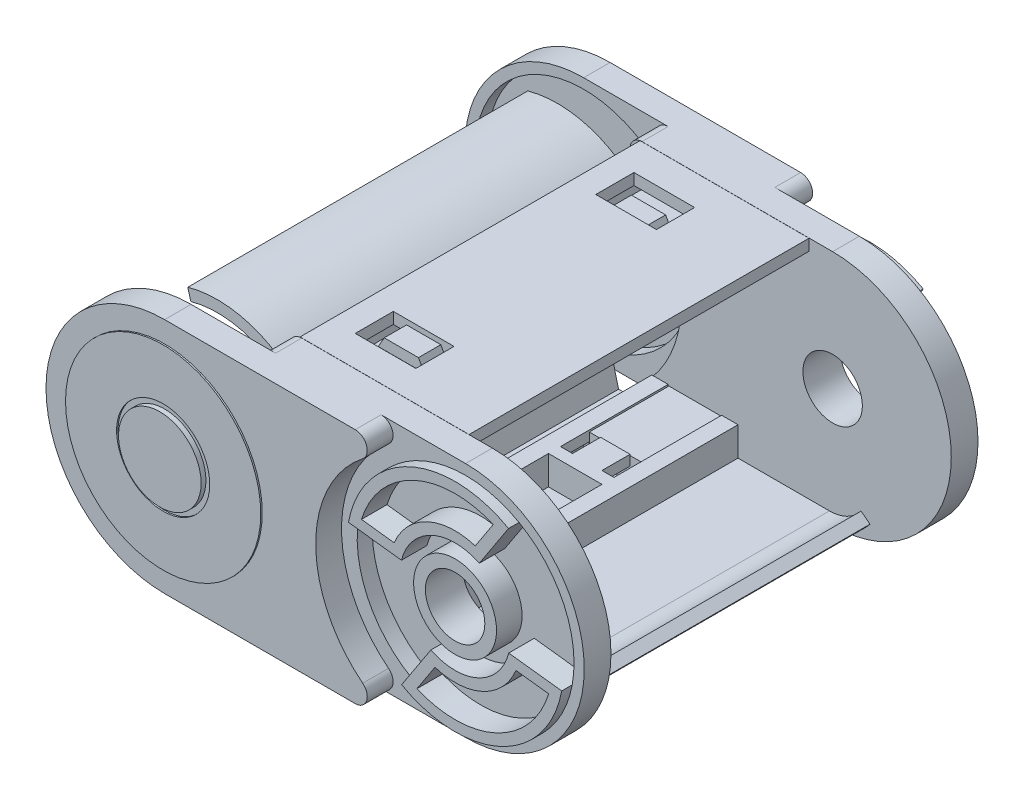
from build123d import *

# Parameters (mm, degrees)
BOSS_EXTRUDE1_START      = 37.075
BOSS_EXTRUDE1_DEPTH      = 8.75
SKETCH3_R                = 20.65
CUT_EXTRUDE2_DEPTH       = 4.3
SKETCH3_3_R              = 5.15
CUT_EXTRUDE10_DEPTH      = 70.017588338
SKETCH3_4_R              = 16.25
SKETCH3_4_R_2            = 7.75
BOSS_EXTRUDE11_DEPTH     = 0.25
SKETCH8_R                = 20.65
CUT_EXTRUDE6_DEPTH       = 4.35
CUT_EXTRUDE7_START       = 4.35
SKETCH9_R                = 18.1
CUT_EXTRUDE7_DEPTH       = 6.5
SKETCH10_R               = 7
BOSS_EXTRUDE3_DEPTH      = 3.9
FILLET1_R                = 0.5
CUT_EXTRUDE8_START       = -4.6
SKETCH11_R               = 7
CUT_EXTRUDE8_DEPTH       = 4.6
FILLET2_R                = 2
SKETCH20_R               = 4.95
CUT_EXTRUDE11_DEPTH      = 69.611715472
SKETCH20_3_R             = 18.05
CUT_EXTRUDE12_DEPTH      = 2.5
BOSS_EXTRUDE12_START     = 4.25
SKETCH21_R               = 6.9
SKETCH21_R_2             = 4.95
BOSS_EXTRUDE12_DEPTH     = 4.25
BOSS_EXTRUDE4_DEPTH      = 13.25
BOSS_EXTRUDE5_START      = -1.1
BOSS_EXTRUDE5_DEPTH      = 4.4
BOSS_EXTRUDE6_DEPTH      = 28.3
SKETCH15_W               = 10.1
SKETCH15_H               = 6.35
CUT_EXTRUDE9_DEPTH       = 5
BOSS_EXTRUDE7_REACH      = 84.254
SKETCH16_W               = 14.35
SKETCH16_H               = 20.75
SKETCH16_W_2             = 8.9
SKETCH16_H_2             = 16.75
SKETCH17_W               = 4.9
SKETCH17_H               = 4.675
BOSS_EXTRUDE8_DEPTH      = 1.7
SKETCH18_R               = 6.875
BOSS_EXTRUDE9_DEPTH      = 0.8
SKETCH19_R               = 5.1
BOSS_EXTRUDE10_DEPTH     = 8
SKETCH22_W               = 12.15
SKETCH22_H               = 56.65
CUT_EXTRUDE13_DEPTH      = 86.39067938
CUT_EXTRUDE14_DEPTH      = 79.239252457
CUT_EXTRUDE14_DEPTH_BACK = 79.239252457
SKETCH24_W               = 38.20570809
SKETCH24_H               = 12.218638483
BOSS_EXTRUDE13_START     = -28.3
BOSS_EXTRUDE13_DEPTH     = 56.6


with BuildPart() as part:
    # Sketch1 → Boss-Extrude1 (new body)
    with BuildSketch(Plane.XY.offset(BOSS_EXTRUDE1_START)):
        with BuildLine():
            Line((0, 19.75), (45.8, 19.75))
            ThreePointArc((45.8, 19.75), (65.55, 0), (45.8, -19.75))
            Line((45.8, -19.75), (0, -19.75))
            ThreePointArc((0, -19.75), (-19.75, 0), (0, 19.75))
        make_face()
    extrude(amount=-BOSS_EXTRUDE1_DEPTH)

    # Sketch3 → Cut-Extrude2 (cut)
    with BuildSketch(Plane.XY.offset(37.075)):
        with Locations((45.8, 0)):
            Circle(SKETCH3_R)
    extrude(amount=-CUT_EXTRUDE2_DEPTH, mode=Mode.SUBTRACT)

    # Sketch3<3> → Cut-Extrude10 (cut, through all)
    with BuildSketch(Plane.XY.offset(37.075)):
        Circle(SKETCH3_3_R)
    extrude(amount=-CUT_EXTRUDE10_DEPTH, mode=Mode.SUBTRACT)

    # Sketch3<4> → Boss-Extrude11 (add)
    with BuildSketch(Plane.XY.offset(37.075)):
        Circle(SKETCH3_4_R)
        Circle(SKETCH3_4_R_2, mode=Mode.SUBTRACT)
    extrude(amount=BOSS_EXTRUDE11_DEPTH)

    # Sketch8 → Cut-Extrude6 (cut)
    with BuildSketch(Plane(origin=(0, 0, 28.325), x_dir=(-1, 0, 0), z_dir=(0, 0, -1))):
        Circle(SKETCH8_R)
    extrude(amount=-CUT_EXTRUDE6_DEPTH, mode=Mode.SUBTRACT)

    # Sketch9 → Cut-Extrude7 (cut)
    with BuildSketch(Plane(origin=(0, 0, 32.675), x_dir=(-1, 0, 0), z_dir=(0, 0, -1)).offset(CUT_EXTRUDE7_START)):
        Circle(SKETCH9_R)
    extrude(amount=-CUT_EXTRUDE7_DEPTH, mode=Mode.SUBTRACT)

    # Sketch10 → Boss-Extrude3 (add)
    with BuildSketch(Plane(origin=(0, 0, 34.825), x_dir=(-1, 0, 0), z_dir=(0, 0, -1))):
        with BuildLine():
            Line((8.562499635, 2.5), (16.75, 3.2))
            Line((16.75, 3.2), (16.75, -3.2))
            Line((16.75, -3.2), (8.562499635, -2.5))
            ThreePointArc((8.562499635, -2.5), (0, -8.92), (-8.562499635, -2.5))
            Line((-8.562499635, -2.5), (-16.75, -3.2))
            Line((-16.75, -3.2), (-16.75, 3.2))
            Line((-16.75, 3.2), (-8.562499635, 2.5))
            ThreePointArc((-8.562499635, 2.5), (0, 8.92), (8.562499635, 2.5))
        make_face()
        Circle(SKETCH10_R, mode=Mode.SUBTRACT)
        with BuildLine():
            Line((8.872361267, 0.920654955), (15.15, 1.457369083))
            Line((15.15, 1.457369083), (15.15, -1.457369083))
            Line((15.15, -1.457369083), (8.872361267, -0.920654955))
            ThreePointArc((8.872361267, -0.920654955), (8.92, 0), (8.872361267, 0.920654955))
        make_face(mode=Mode.SUBTRACT)
        with BuildLine():
            Line((-8.872361267, 0.920654955), (-15.15, 1.457369083))
            Line((-15.15, 1.457369083), (-15.15, -1.457369083))
            Line((-15.15, -1.457369083), (-8.872361267, -0.920654955))
            ThreePointArc((-8.872361267, -0.920654955), (-8.92, 0), (-8.872361267, 0.920654955))
        make_face(mode=Mode.SUBTRACT)
    extrude(amount=BOSS_EXTRUDE3_DEPTH)

    # Fillet1
    fillet1_edges = [part.edges().sort_by_distance(p)[0] for p in [
        (16.75, 3.2, 32.875),
        (16.75, -3.2, 32.875),
        (-16.75, -3.2, 32.875),
        (-16.75, 3.2, 32.875),
    ]]
    fillet(fillet1_edges, radius=FILLET1_R)

    # Sketch11 → Cut-Extrude8 (cut)
    with BuildSketch(Plane(origin=(0, 0, 30.925), x_dir=(-1, 0, 0), z_dir=(0, 0, -1)).offset(CUT_EXTRUDE8_START)):
        Circle(SKETCH11_R)
    extrude(amount=CUT_EXTRUDE8_DEPTH, mode=Mode.SUBTRACT)

    # Fillet2
    fillet2_edges = [part.edges().sort_by_distance(p)[0] for p in [
        (39.770074627, 19.75, 34.925),
        (39.770074627, -19.75, 34.925),
        (6.029925373, 19.75, 30.5),
        (6.029925373, -19.75, 30.5),
    ]]
    fillet(fillet2_edges, radius=FILLET2_R)

    # Sketch20 → Cut-Extrude11 (cut, through all)
    with BuildSketch(Plane.XY.offset(32.775)):
        with Locations((45.8, 0)):
            Circle(SKETCH20_R)
    extrude(amount=-CUT_EXTRUDE11_DEPTH, mode=Mode.SUBTRACT)

    # Sketch20<3> → Cut-Extrude12 (cut)
    with BuildSketch(Plane.XY.offset(32.775)):
        with Locations((45.8, 0)):
            Circle(SKETCH20_3_R)
    extrude(amount=-CUT_EXTRUDE12_DEPTH, mode=Mode.SUBTRACT)

    # Sketch21 → Boss-Extrude12 (add)
    # profile 1 of 3: a face of its own
    with BuildSketch(Plane.XY.offset(30.275).offset(BOSS_EXTRUDE12_START)):
        with Locations((45.8, 0)):
            Circle(SKETCH21_R)
        with Locations((45.8, 0)):
            Circle(SKETCH21_R_2, mode=Mode.SUBTRACT)
    # profile 2 of 3: a face of its own
    with BuildSketch(Plane.XY.offset(30.275).offset(BOSS_EXTRUDE12_START)):
        with BuildLine():
            Line((54.696062952, 15.705494706), (49.833381824, 8.268726084))
            ThreePointArc((49.833381824, 8.268726084), (41.911911992, 8.338031641), (36.87318047, 2.225284942))
            Line((36.87318047, 2.225284942), (28.050614014, 3.28051781))
            ThreePointArc((28.050614014, 3.28051781), (38.171740376, 16.358855556), (54.696062952, 15.705494706))
        make_face()
        with BuildLine():
            Line((52.151463457, 15.011625893), (49.15197162, 10.42433625))
            ThreePointArc((49.15197162, 10.42433625), (41.172330034, 9.924070268), (35.659889317, 4.132874948))
            Line((35.659889317, 4.132874948), (30.217785389, 4.783783838))
            ThreePointArc((30.217785389, 4.783783838), (38.911322334, 14.772816929), (52.151463457, 15.011625893))
        make_face(mode=Mode.SUBTRACT)
    # profile 3 of 3: a face of its own
    with BuildSketch(Plane.XY.offset(30.275).offset(BOSS_EXTRUDE12_START)):
        with BuildLine():
            Line((36.903937048, -15.705494706), (41.766618176, -8.268726084))
            ThreePointArc((41.766618176, -8.268726084), (49.688088008, -8.338031641), (54.72681953, -2.225284942))
            Line((54.72681953, -2.225284942), (63.549385986, -3.28051781))
            ThreePointArc((63.549385986, -3.28051781), (53.428259624, -16.358855556), (36.903937048, -15.705494706))
        make_face()
        with BuildLine():
            Line((39.448536543, -15.011625893), (42.44802838, -10.42433625))
            ThreePointArc((42.44802838, -10.42433625), (50.427669966, -9.924070268), (55.940110683, -4.132874948))
            Line((55.940110683, -4.132874948), (61.382214611, -4.783783838))
            ThreePointArc((61.382214611, -4.783783838), (52.688677666, -14.772816929), (39.448536543, -15.011625893))
        make_face(mode=Mode.SUBTRACT)
    extrude(amount=-BOSS_EXTRUDE12_DEPTH)

    # Sketch12 → Boss-Extrude4 (add)
    with BuildSketch(Plane(origin=(0, 0, 28.325), x_dir=(-1, 0, 0), z_dir=(0, 0, -1))):
        Polygon((-27.45, 17.15), (-18.35, 17.15), (-17.525, 15.65), (-17.525, 14.85), (-18.55, 14.85), (-18.55, 13.25), (-27.25, 13.25), (-27.25, 14.85), (-28.275, 14.85), (-28.275, 15.65), align=None)
        Polygon((-17.525, -15.65), (-17.525, -14.85), (-18.55, -14.85), (-18.55, -13.25), (-27.25, -13.25), (-27.25, -14.85), (-28.275, -14.85), (-28.275, -15.65), (-27.45, -17.15), (-18.35, -17.15), align=None)
    extrude(amount=BOSS_EXTRUDE4_DEPTH)

    # Sketch13 → Boss-Extrude5 (add)
    with BuildSketch(Plane(origin=(0, 0, 15.075), x_dir=(-1, 0, 0), z_dir=(0, 0, -1)).offset(BOSS_EXTRUDE5_START)):
        Polygon((-26.725, 17.15), (-25.75, 18.9), (-20.05, 18.9), (-19.075, 17.15), align=None)
        Polygon((-20.05, -18.9), (-19.075, -17.15), (-26.725, -17.15), (-25.75, -18.9), align=None)
    extrude(amount=-BOSS_EXTRUDE5_DEPTH)


with BuildPart() as body_2:
    # Sketch14 → Boss-Extrude6 (new, symmetric)
    with BuildSketch(Plane.XY):
        with BuildLine():
            Line((45.287324477, 19.75), (8.74, 19.75))
            Line((8.74, 19.75), (7.225327065, 13.882260219))
            ThreePointArc((7.225327065, 13.882260219), (-1.887976259, 15.53570229), (-10.34, 11.747633804))
            Line((-10.34, 11.747633804), (-9.097878594, 10.336416453))
            ThreePointArc((-9.097878594, 10.336416453), (-0.452033649, 13.76257845), (8.4, 10.911136513))
            Line((8.4, 10.911136513), (10.196330883, 17.87))
            Line((10.196330883, 17.87), (15.725, 17.87))
            Line((15.725, 17.87), (15.725, 13.05))
            Line((15.725, 13.05), (18.45, 13.05))
            Line((18.45, 13.05), (18.45, 14.75))
            Line((18.45, 14.75), (17.425, 14.75))
            Line((17.425, 14.75), (17.425, 17.87))
            Line((17.425, 17.87), (28.375, 17.87))
            Line((28.375, 17.87), (28.375, 14.75))
            Line((28.375, 14.75), (27.35, 14.75))
            Line((27.35, 14.75), (27.35, 13.05))
            Line((27.35, 13.05), (30.075, 13.05))
            Line((30.075, 13.05), (30.075, 17.87))
            Line((30.075, 17.87), (45.287324477, 17.87))
            ThreePointArc((45.287324477, 17.87), (48.226296513, 17.181849911), (50.554255296, 15.260466275))
            Line((50.554255296, 15.260466275), (52.05, 16.399390233))
            ThreePointArc((52.05, 16.399390233), (49.060929055, 18.866423602), (45.287324477, 19.75))
        make_face()
    extrude(amount=BOSS_EXTRUDE6_DEPTH, both=True)

    # Sketch15 → Cut-Extrude9 (cut)
    with BuildSketch(Plane(origin=(0, 19.75, 0), x_dir=(1, 0, 0), z_dir=(0, 1, 0))):
        with Locations((22.9, -20.025)):
            Rectangle(SKETCH15_W, SKETCH15_H)
        with Locations((22.9, 20.025)):
            Rectangle(SKETCH15_W, SKETCH15_H)
    extrude(amount=-CUT_EXTRUDE9_DEPTH, mode=Mode.SUBTRACT)

    # Boss-Extrude7: up to this face of the body (flat: up to its plane)
    boss_extrude7_end = Plane(body_2.part.faces().sort_by_distance((37.681162238, 17.87, 0))[0])
    # Sketch16 → Boss-Extrude7 (add, up to the picked face)
    with BuildSketch(Plane.XZ.offset(-13.05), mode=Mode.PRIVATE) as boss_extrude7_sk1:
        with Locations((22.9, 0)):
            Rectangle(SKETCH16_W, SKETCH16_H)
        with Locations((22.9, 0)):
            Rectangle(SKETCH16_W_2, SKETCH16_H_2, mode=Mode.SUBTRACT)
    boss_extrude7_tool1 = split(extrude(boss_extrude7_sk1.sketch, amount=-BOSS_EXTRUDE7_REACH, mode=Mode.PRIVATE), bisect_by=boss_extrude7_end, keep=Keep.BOTH, mode=Mode.PRIVATE)
    add(boss_extrude7_tool1.solids().sort_by(Axis((22.9, 13.05, 10.122713), (0, 1, 0)))[0])

    # Sketch17 → Boss-Extrude8 (add)
    with BuildSketch(Plane.XZ.offset(-13.05)):
        with Locations((22.9, 12.7125)):
            Rectangle(SKETCH17_W, SKETCH17_H)
        with Locations((22.9, -12.7125)):
            Rectangle(SKETCH17_W, SKETCH17_H)
    extrude(amount=-BOSS_EXTRUDE8_DEPTH)


with BuildPart() as body_3:
    # Sketch18 → Boss-Extrude9 (new body)
    with BuildSketch(Plane.XY.offset(37.075)):
        Circle(SKETCH18_R)
    extrude(amount=BOSS_EXTRUDE9_DEPTH)

    # Sketch19 → Boss-Extrude10 (add)
    with BuildSketch(Plane(origin=(0, 0, 37.075), x_dir=(-1, 0, 0), z_dir=(0, 0, -1))):
        Circle(SKETCH19_R)
    extrude(amount=BOSS_EXTRUDE10_DEPTH)


with BuildPart() as body_4:
    # Mirror1: mirrored copy
    add(part.part.mirror(Plane.XY))


with BuildPart() as body_5:
    # Mirror1 2: mirrored copy
    add(body_3.part.mirror(Plane.XY))


with BuildPart() as body_6:
    # Mirror2: mirrored copy
    add(body_2.part.mirror(Plane.ZX))


with BuildPart() as body_2_1:
    add(body_2.part)

    # Sketch22 → Cut-Extrude13 (cut, through all)
    with BuildSketch(Plane.XZ.offset(19.75)):
        with Locations((47.975, 0)):
            Rectangle(SKETCH22_W, SKETCH22_H)
    extrude(amount=-CUT_EXTRUDE13_DEPTH, mode=Mode.SUBTRACT)

    # Sketch24 → Cut-Extrude14 (cut, two sides: drawn at the far end of the back side and taken through both)
    with BuildSketch(Plane.XY.offset(-CUT_EXTRUDE14_DEPTH_BACK)):
        with Locations((-3.877854045, 13.640680759)):
            Rectangle(SKETCH24_W, SKETCH24_H)
    extrude(amount=CUT_EXTRUDE14_DEPTH + CUT_EXTRUDE14_DEPTH_BACK, mode=Mode.SUBTRACT)


with BuildPart() as part_1:
    add(part.part)

    add(body_2_1.part)  # Boss-Extrude13 merges body 2
    # Sketch23 → Boss-Extrude13 (add)
    with BuildSketch(Plane.XY.offset(BOSS_EXTRUDE13_START)):
        with BuildLine():
            Line((15.225, 17.87), (14.199854415, 13.89865583))
            ThreePointArc((14.199854415, 13.89865583), (12.633793675, 12.230961839), (10.385472043, 12.653808535))
            ThreePointArc((10.385472043, 12.653808535), (3.364510308, 16.02051717), (-4.417657534, 15.762652122))
            Line((-4.417657534, 15.762652122), (-4.925, 17.572901724))
            ThreePointArc((-4.925, 17.572901724), (3.750904895, 17.860381084), (11.578183554, 14.107025398))
            ThreePointArc((11.578183554, 14.107025398), (12.050520031, 14.018192059), (12.379524389, 14.368547939))
            Line((12.379524389, 14.368547939), (13.768669117, 19.75))
            Line((13.768669117, 19.75), (15.225, 19.75))
            Line((15.225, 19.75), (15.225, 17.87))
        make_face()
    extrude(amount=BOSS_EXTRUDE13_DEPTH)


solid = Compound([body_3.part, body_4.part, body_5.part, body_6.part, part_1.part])
